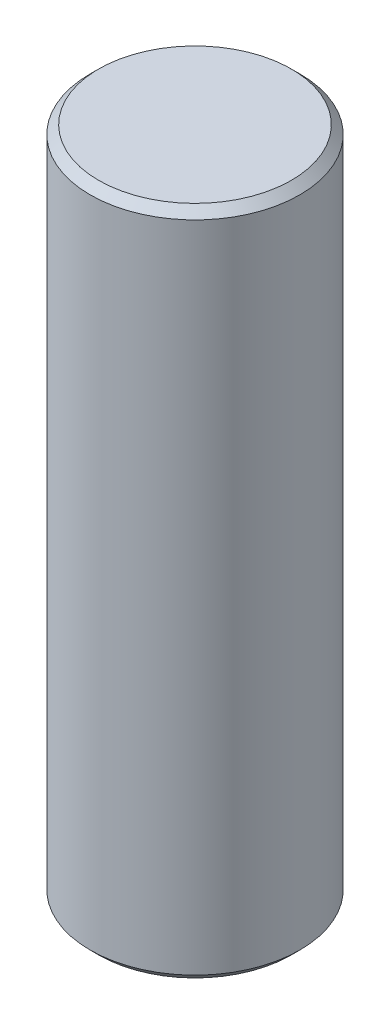
from build123d import *

# Parameters (mm, degrees)
SKETCH1_R           = 2.5
BOSS_EXTRUDE1_DEPTH = 16
CHAMFER1_SIZE       = 0.2


with BuildPart() as part:
    # Sketch1 → Boss-Extrude1 (new body)
    with BuildSketch(Plane(origin=(0, 0, 0), x_dir=(1, 0, 0), z_dir=(0, 1, 0))):
        with Locations(Location((0, 0, 0), (0, 0, 270))):
            Circle(SKETCH1_R)
    extrude(amount=BOSS_EXTRUDE1_DEPTH)

    # Chamfer1
    chamfer1_edges = [part.edges().sort_by_distance(p)[0] for p in [
        (0, 0, -2.5),
        (0, 16, -2.5),
    ]]
    chamfer(chamfer1_edges, length=CHAMFER1_SIZE)


solid = part.part
